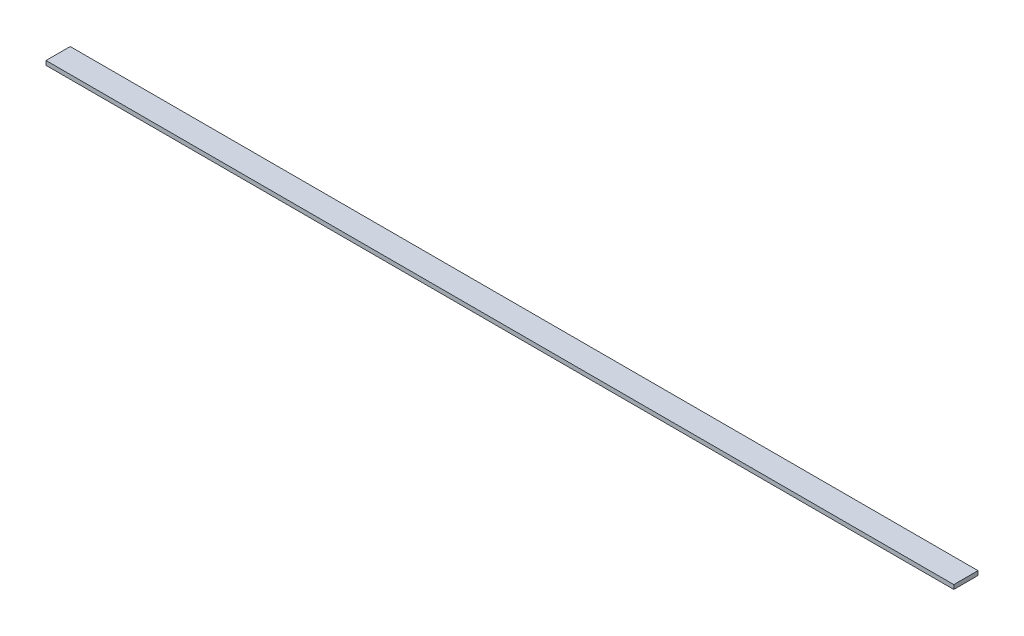
from build123d import *

# Parameters (mm, degrees)
SKIZZE1_W                       = 1500
SKIZZE1_H                       = 40
AUFSATZ_LINEAR_AUSTRAGEN1_DEPTH = 7


with BuildPart() as part:
    # Skizze1 → Aufsatz-Linear austragen1 (new body)
    with BuildSketch(Plane(origin=(0, 0, 0), x_dir=(1, 0, 0), z_dir=(0, 1, 0))):
        Rectangle(SKIZZE1_W, SKIZZE1_H)
    extrude(amount=AUFSATZ_LINEAR_AUSTRAGEN1_DEPTH)


solid = part.part
